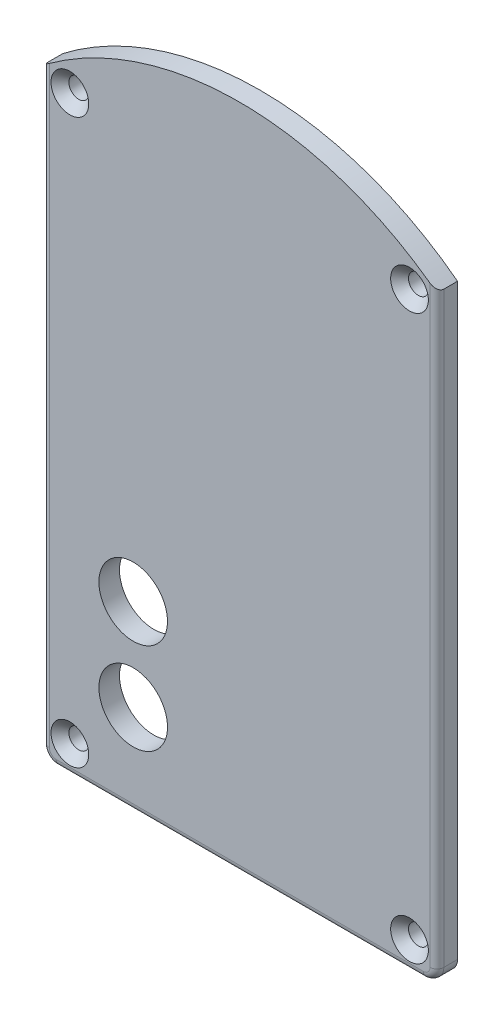
from build123d import *

# Parameters (mm, degrees)
SCHIZZO4_W                               = 57.5
SCHIZZO4_H                               = 100
ESTRUSIONE_ESTRUSIONE2_DEPTH             = 3
TAGLIO_ESTRUSIONE2_REACH                 = 59.754
SCHIZZO7_R                               = 5
RACCORDO1_R                              = 2
RACCORDO3_R                              = 2
RACCORDO4_R                              = 1
FORO_SVASATO_PER_VITE_M2_5_1_D           = 2.9
FORO_SVASATO_PER_VITE_M2_5_1_CSINK_D     = 5.5
FORO_SVASATO_PER_VITE_M2_5_1_CSINK_ANGLE = 90


with BuildPart() as part:
    # Schizzo4 → Estrusione-Estrusione2 (new body)
    with BuildSketch(Plane.XY):
        Rectangle(SCHIZZO4_W, SCHIZZO4_H)
    extrude(amount=ESTRUSIONE_ESTRUSIONE2_DEPTH)

    # Schizzo7 → Taglio-Estrusione2 (cut, up to next)
    with BuildSketch(Plane.XY, mode=Mode.PRIVATE) as taglio_estrusione2_sk1:
        with Locations(Location((-15.52, -36.81, 0), (0, 0, 180))):
            Circle(SCHIZZO7_R)
    taglio_estrusione2_tool1 = extrude(taglio_estrusione2_sk1.sketch, amount=TAGLIO_ESTRUSIONE2_REACH, mode=Mode.PRIVATE) & part.part
    # Schizzo7 → Taglio-Estrusione2 (cut, up to next)
    with BuildSketch(Plane.XY, mode=Mode.PRIVATE) as taglio_estrusione2_sk2:
        with Locations(Location((-15.52, -23.47, 0), (0, 0, 180))):
            Circle(SCHIZZO7_R)
    taglio_estrusione2_tool2 = extrude(taglio_estrusione2_sk2.sketch, amount=TAGLIO_ESTRUSIONE2_REACH, mode=Mode.PRIVATE) & part.part
    # Schizzo7 → Taglio-Estrusione2 (cut, up to next)
    with BuildSketch(Plane.XY, mode=Mode.PRIVATE) as taglio_estrusione2_sk3:
        with BuildLine():
            Line((-28.75, 37.61), (-28.75, 50))
            Line((-28.75, 50), (28.75, 50))
            Line((28.75, 50), (28.75, 37.61))
            ThreePointArc((28.75, 37.61), (0, 47.339989438), (-28.75, 37.61))
        make_face()
    taglio_estrusione2_tool3 = extrude(taglio_estrusione2_sk3.sketch, amount=TAGLIO_ESTRUSIONE2_REACH, mode=Mode.PRIVATE) & part.part
    add(taglio_estrusione2_tool1.solids().sort_by_distance((-15.52, -36.81, 0))[0], mode=Mode.SUBTRACT)
    add(taglio_estrusione2_tool2.solids().sort_by_distance((-15.52, -23.47, 0))[0], mode=Mode.SUBTRACT)
    add(taglio_estrusione2_tool3.solids().sort_by_distance((-28.161803, 43.805, 0))[0], mode=Mode.SUBTRACT)

    # Raccordo1
    raccordo1_edges = [part.edges().sort_by_distance(p)[0] for p in [
        (-28.75, -50, 1.5),
    ]]
    fillet(raccordo1_edges, radius=RACCORDO1_R)

    # Raccordo3
    raccordo3_edges = [part.edges().sort_by_distance(p)[0] for p in [
        (28.75, -50, 1.5),
    ]]
    fillet(raccordo3_edges, radius=RACCORDO3_R)

    # Raccordo4
    raccordo4_edges = [part.edges().sort_by_distance(p)[0] for p in [
        (-28.75, -5.195, 3),
        (0, -50, 3),
        (-28.164213562, -49.414213562, 3),
        (28.75, -5.195, 3),
        (28.164213562, -49.414213562, 3),
    ]]
    fillet(raccordo4_edges, radius=RACCORDO4_R)

    # Foro svasato per Vite M2.5-1 (through all)
    with Locations(Plane.XY.offset(3)):
        with Locations((-24.75, 36.11), (24.75, -46), (-24.75, -46), (24.75, 36.11)):
            CounterSinkHole(FORO_SVASATO_PER_VITE_M2_5_1_D / 2, FORO_SVASATO_PER_VITE_M2_5_1_CSINK_D / 2, counter_sink_angle=FORO_SVASATO_PER_VITE_M2_5_1_CSINK_ANGLE)


solid = part.part
